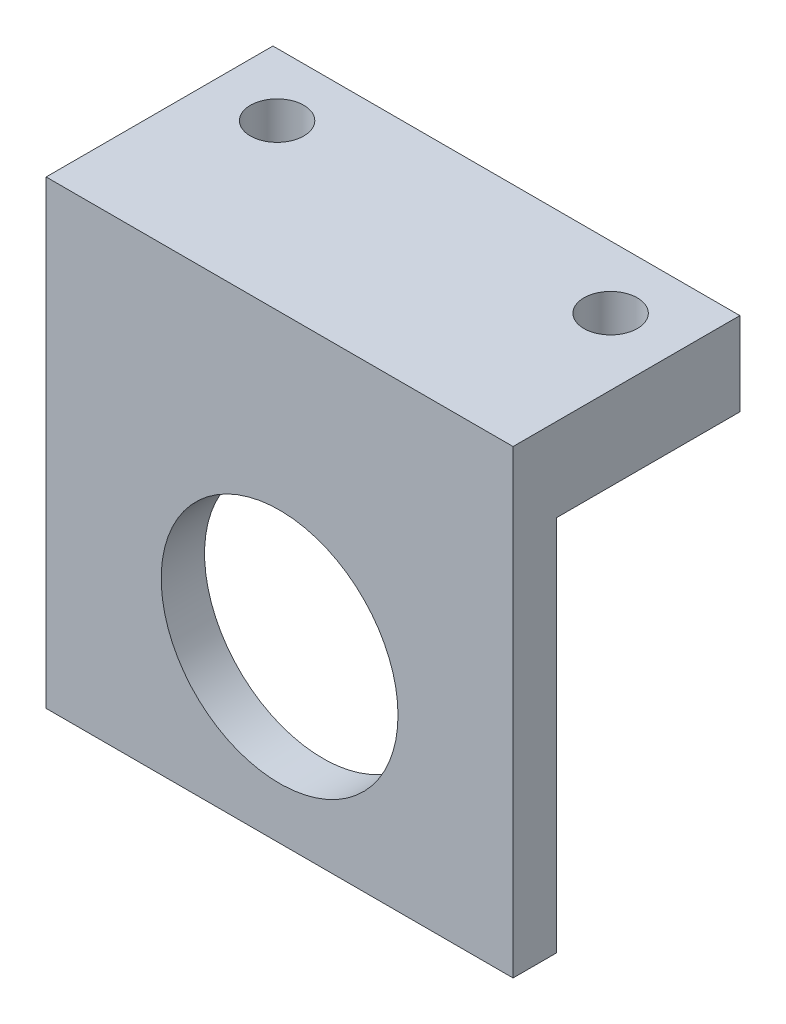
from build123d import *

# Parameters (mm, degrees)
SKETCH11_W          = 35.56
SKETCH11_H          = 32.385
SKETCH11_R          = 2.032
BOSS_EXTRUDE1_DEPTH = 6.35
SKETCH14_W          = 35.56
SKETCH14_H          = 3.302
BOSS_EXTRUDE2_DEPTH = 28.702
CUT_EXTRUDE1_REACH  = 50.853
SKETCH15_R          = 9.017
SKETCH16_W          = 35.56
SKETCH16_H          = 15.113
CUT_EXTRUDE2_DEPTH  = 57.009879745


with BuildPart() as part:
    # Sketch11 → Boss-Extrude1 (new body)
    with BuildSketch(Plane(origin=(0, 0, 0), x_dir=(1, 0, 0), z_dir=(0, 1, 0))):
        with Locations((17.78, 16.1925)):
            Rectangle(SKETCH11_W, SKETCH11_H)
        with Locations(Location((5.08, 27.6225, 0), (0, 0, 270))):
            Circle(SKETCH11_R, mode=Mode.SUBTRACT)
        with Locations(Location((30.48, 27.6225, 0), (0, 0, 270))):
            Circle(SKETCH11_R, mode=Mode.SUBTRACT)
        with Locations(Location((17.78, 6.7945, 0), (0, 0, 270))):
            Circle(SKETCH11_R, mode=Mode.SUBTRACT)
    extrude(amount=BOSS_EXTRUDE1_DEPTH)

    # Sketch14 → Boss-Extrude2 (add)
    with BuildSketch(Plane.XZ):
        with Locations((17.78, -16.764)):
            Rectangle(SKETCH14_W, SKETCH14_H)
    extrude(amount=BOSS_EXTRUDE2_DEPTH)

    # Sketch15 → Cut-Extrude1 (cut, up to next)
    with BuildSketch(Plane.XY.offset(-15.113), mode=Mode.PRIVATE) as cut_extrude1_sk1:
        with Locations((17.78, -15.748)):
            Circle(SKETCH15_R)
    cut_extrude1_tool1 = extrude(cut_extrude1_sk1.sketch, amount=-CUT_EXTRUDE1_REACH, mode=Mode.PRIVATE) & part.part
    add(cut_extrude1_tool1.solids().sort_by_distance((17.78, -15.748, -15.113))[0], mode=Mode.SUBTRACT)

    # Sketch16 → Cut-Extrude2 (cut, through all)
    with BuildSketch(Plane.XZ):
        with Locations((17.78, -7.5565)):
            Rectangle(SKETCH16_W, SKETCH16_H)
    extrude(amount=-CUT_EXTRUDE2_DEPTH, mode=Mode.SUBTRACT)


solid = part.part
